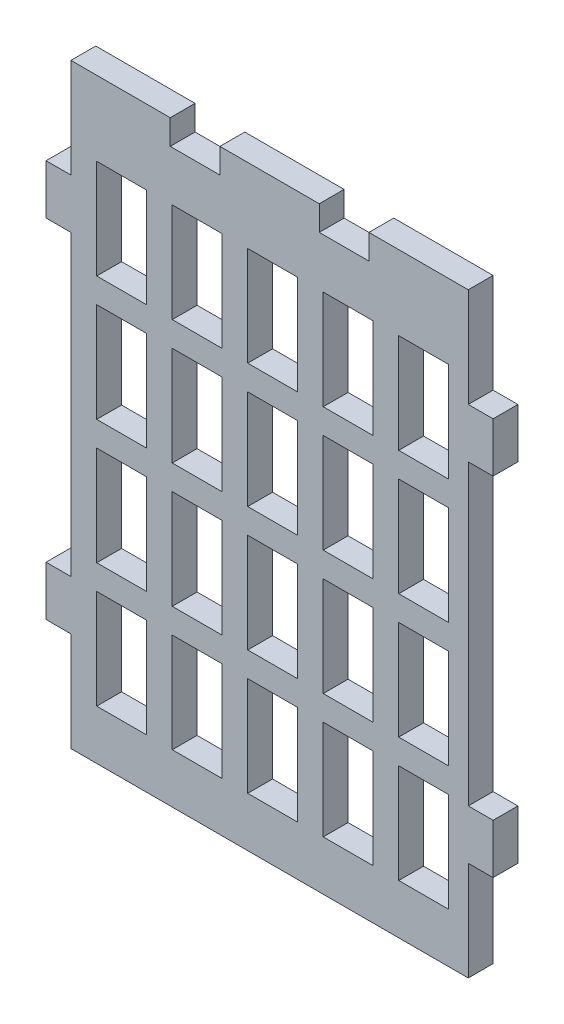
from build123d import *

# Parameters (mm, degrees)
BOSS_EXTRUDE1_DEPTH  = 3.175
SKETCH2_W            = 6.345309088
SKETCH2_H            = 12.7
CUT_EXTRUDE1_DEPTH   = 5.08
LPATTERN1_COUNT      = 5
LPATTERN1_PITCH      = 9.652
LPATTERN1_COUNT_DIR2 = 4
LPATTERN1_PITCH_DIR2 = 15.875


with BuildPart() as part:
    # Sketch1 → Boss-Extrude1 (new body)
    with BuildSketch(Plane.XY):
        Polygon((31.75, 0), (19.05, 0), (19.05, -3.175), (12.7, -3.175), (12.7, 0), (0, 0), (0, -12.7), (-3.175, -12.7), (-3.175, -19.05), (0, -19.05), (0, -57.15), (-3.175, -57.15), (-3.175, -63.5), (0, -63.5), (0, -76.2), (12.7, -76.2), (38.1, -76.2), (50.8, -76.2), (50.8, -63.5), (53.975, -63.5), (53.975, -57.15), (50.8, -57.15), (50.8, -19.05), (53.975, -19.05), (53.975, -12.7), (50.8, -12.7), (50.8, 0), (38.1, 0), (38.1, -3.175), (31.75, -3.175), align=None)
    extrude(amount=BOSS_EXTRUDE1_DEPTH)

    # Sketch2 → Cut-Extrude1 (cut)
    with BuildSketch(Plane.XY.offset(3.175)):
        with Locations((6.474654544, -15.875)):
            Rectangle(SKETCH2_W, SKETCH2_H)
    cut_extrude1 = extrude(amount=-CUT_EXTRUDE1_DEPTH, mode=Mode.SUBTRACT)

    # LPattern1: Cut-Extrude1 5 × 4
    with Locations(*[(i * LPATTERN1_PITCH, -j * LPATTERN1_PITCH_DIR2, 0) for i in range(LPATTERN1_COUNT) for j in range(LPATTERN1_COUNT_DIR2) if (i, j) != (0, 0)]):
        add(cut_extrude1, mode=Mode.SUBTRACT)


solid = part.part
